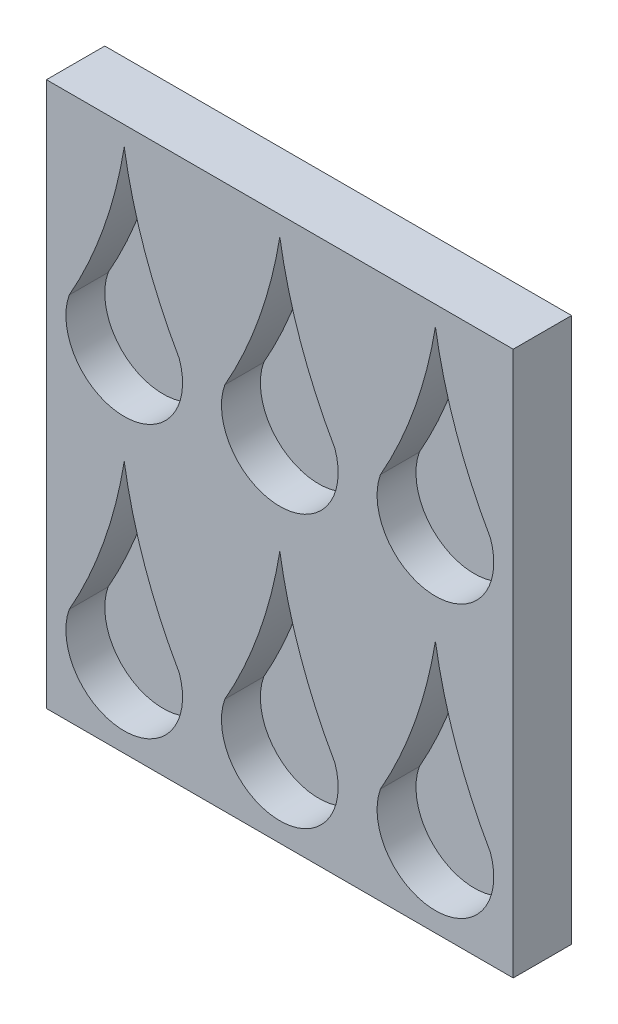
from build123d import *

# Parameters (mm, degrees)
SKETCH1_W            = 50.8
SKETCH1_H            = 88.9
BOSS_EXTRUDE1_DEPTH  = 19.05
CUT_EXTRUDE1_DEPTH   = 12.7
LPATTERN1_COUNT      = 3
LPATTERN1_PITCH      = 50.8
LPATTERN1_COUNT_DIR2 = 2
LPATTERN1_PITCH_DIR2 = 88.9


with BuildPart() as part:
    # Sketch1 → Boss-Extrude1 (new body)
    with BuildSketch(Plane.XY):
        Rectangle(SKETCH1_W, SKETCH1_H)
    boss_extrude1 = extrude(amount=BOSS_EXTRUDE1_DEPTH)

    # Sketch2 → Cut-Extrude1 (cut)
    with BuildSketch(Plane.XY.offset(19.05)):
        with BuildLine():
            ThreePointArc((-17.960512242, -12.7), (0, -38.1), (17.960512242, -12.7))
            ThreePointArc((17.960512242, -12.7), (6.717373, 11.89995), (0, 38.1))
            ThreePointArc((0, 38.1), (-6.717373, 11.89995), (-17.960512242, -12.7))
        make_face()
    cut_extrude1 = extrude(amount=-CUT_EXTRUDE1_DEPTH, mode=Mode.SUBTRACT)

    # LPattern1: Boss-Extrude1, Cut-Extrude1 3 × 2
    with Locations(*[(i * LPATTERN1_PITCH, j * LPATTERN1_PITCH_DIR2, 0) for i in range(LPATTERN1_COUNT) for j in range(LPATTERN1_COUNT_DIR2) if (i, j) != (0, 0)]):
        add(boss_extrude1)
        add(cut_extrude1, mode=Mode.SUBTRACT)


solid = part.part
